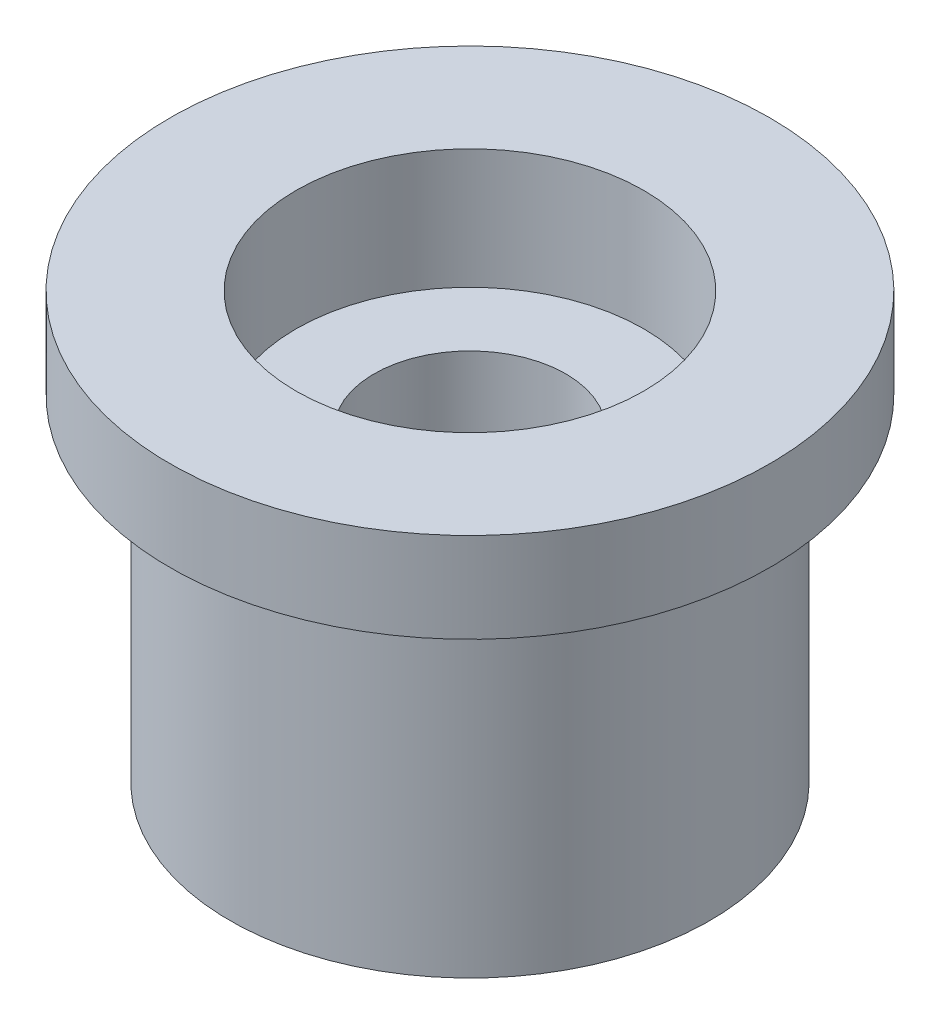
from build123d import *


with BuildPart() as part:
    # Sketch2 → Revolve2 (revolve)
    with BuildSketch(Plane.XY, mode=Mode.PRIVATE) as revolve2_sk:
        Polygon((-1.6, 0), (-4, 0), (-4, 5.6), (-5, 5.6), (-5, 7.1), (-2.9, 7.1), (-2.9, 5.1), (-1.6, 5.1), align=None)
    revolve(revolve2_sk.sketch.rotate(Axis((0, 0, 0), (0, 1, 0)), 270), axis=Axis((0, 0, 0), (0, 1, 0)))


solid = part.part
